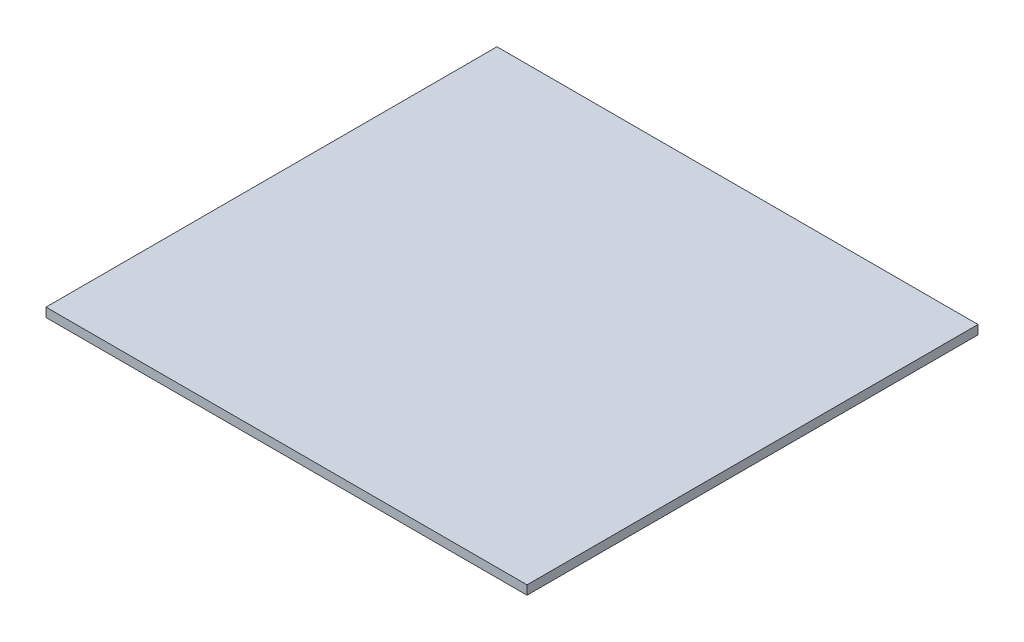
from build123d import *

# Parameters (mm, degrees)
SKETCH_1_W      = 160
SKETCH_1_H      = 150
EXTRUDE_1_DEPTH = 3


with BuildPart() as part:
    # Эскиз1 → Вытянуть1 (new body)
    with BuildSketch(Plane(origin=(0, 0, 0), x_dir=(1, 0, 0), z_dir=(0, 1, 0))):
        with Locations((80, 19.006856966)):
            Rectangle(SKETCH_1_W, SKETCH_1_H)
    extrude(amount=EXTRUDE_1_DEPTH)


solid = part.part
